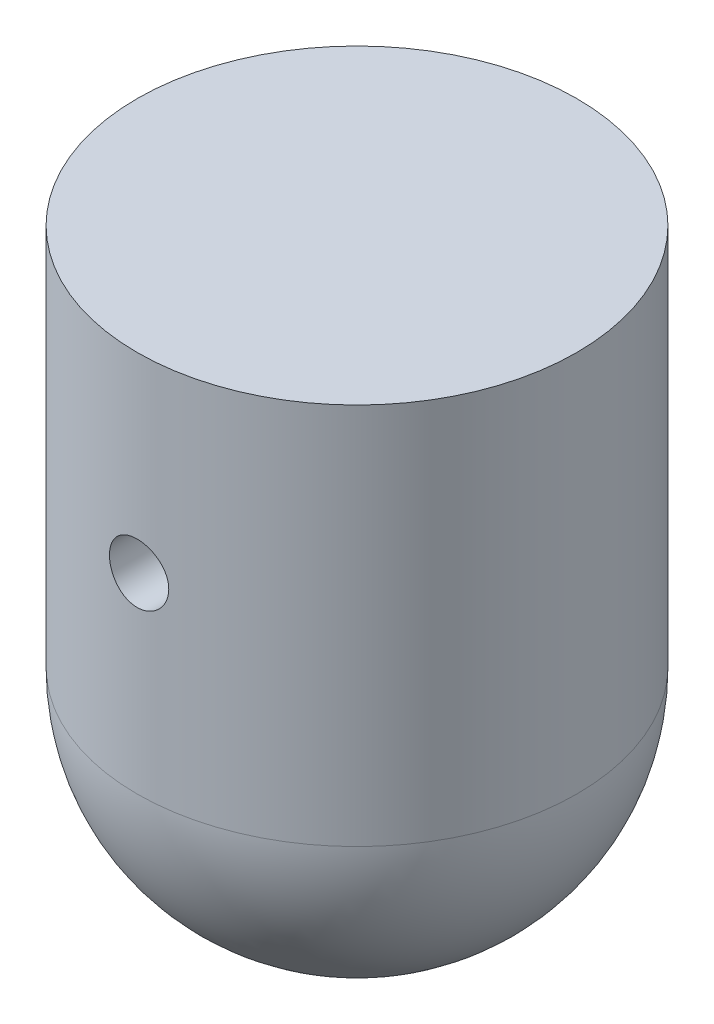
from build123d import *

# Parameters (mm, degrees)
REVOLVE1_ANGLE      = 180
SKETCH4_R           = 11.5
BOSS_EXTRUDE1_DEPTH = 20
SKETCH5_R           = 1.55
CUT_EXTRUDE1_DEPTH  = 11.5


with BuildPart() as part:
    # Sketch1 → Revolve1 (revolve)
    with BuildSketch(Plane(origin=(0, 0, 0), x_dir=(1, 0, 0), z_dir=(0, 1, 0))):
        with BuildLine():
            Line((0, 11.5), (0, -11.5))
            ThreePointArc((0, -11.5), (-11.5, 0), (0, 11.5))
        make_face()
    revolve(axis=Axis((0, 0, -22.021429017), (0, 0, 1)), revolution_arc=REVOLVE1_ANGLE)

    # Sketch4 → Boss-Extrude1 (add)
    with BuildSketch(Plane(origin=(0, 0, 0), x_dir=(1, 0, 0), z_dir=(0, 1, 0))):
        with Locations(Location((0, 0, 0), (0, 0, 180))):
            Circle(SKETCH4_R)
    extrude(amount=BOSS_EXTRUDE1_DEPTH)

    # Sketch5 → Cut-Extrude1 (cut, symmetric)
    with BuildSketch(Plane.XY):
        with Locations((0, 10)):
            Circle(SKETCH5_R)
    extrude(amount=CUT_EXTRUDE1_DEPTH, both=True, mode=Mode.SUBTRACT)


solid = part.part
